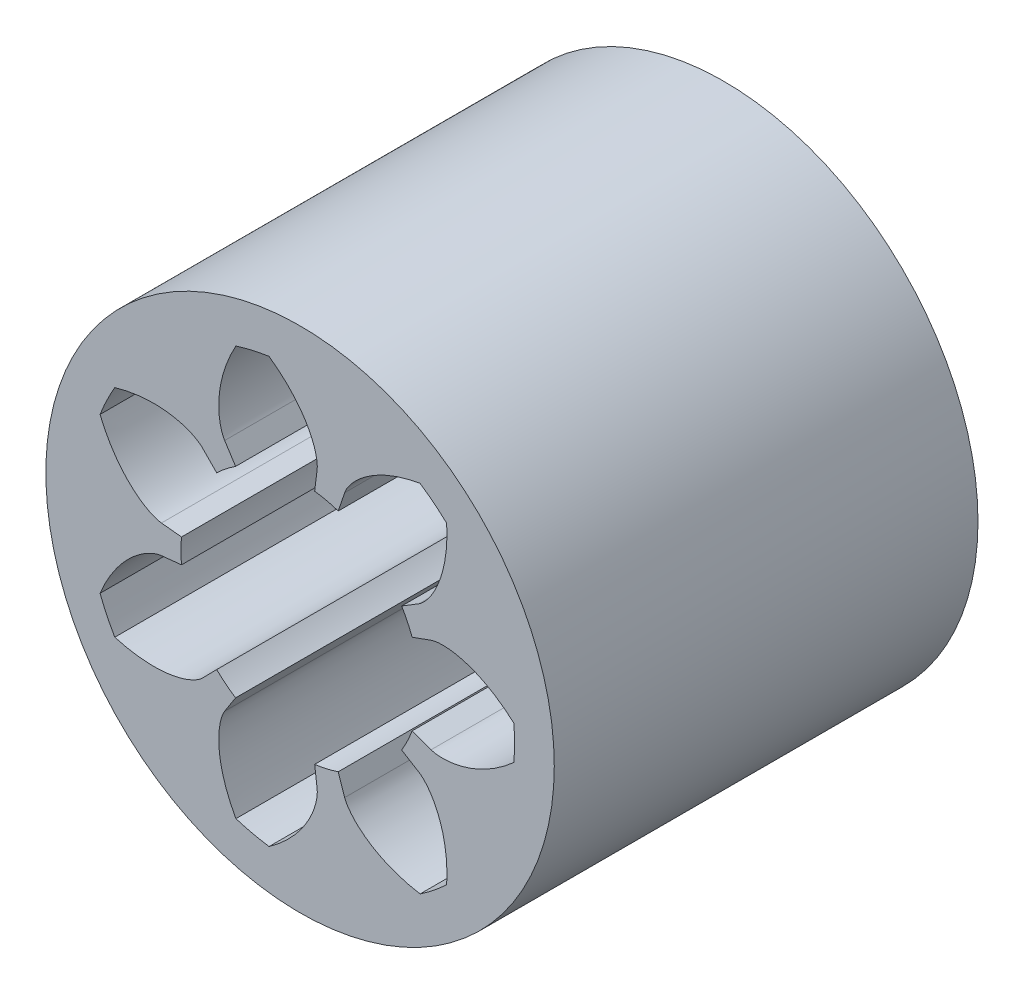
from build123d import *

# Parameters (mm, degrees)
SKETCH_1_R               = 3
SKETCH_1_R_2             = 1.40625
EXTRUDE_1_DEPTH          = 5
CUT_EXTRUDE_2_DEPTH      = 7.557438524
PATTERN_CIRCULAR_1_COUNT = 7


with BuildPart() as part:
    # 草图1 → 凸台-拉伸1 (new body)
    with BuildSketch(Plane.XY):
        Circle(SKETCH_1_R)
        Circle(SKETCH_1_R_2, mode=Mode.SUBTRACT)
    extrude(amount=EXTRUDE_1_DEPTH)

    # 草图1<3> → 切除-拉伸2 (cut, through all)
    with BuildSketch(Plane.XY):
        with BuildLine():
            Line((1.546319716, 0.559598866), (1.322324253, 0.478536971))
            ThreePointArc((1.322324253, 0.478536971), (1.385109661, 0.242920339), (1.40625, 0))
            ThreePointArc((1.40625, 0), (1.385109661, -0.242920339), (1.322324253, -0.478536971))
            Line((1.322324253, -0.478536971), (1.546319716, -0.559598866))
            add(Edge.make_bspline(
                [(1.546319716, -0.559598866), (1.558105463, -0.563864019), (1.591921474, -0.573215837), (1.658734166, -0.580959295), (1.767731952, -0.57845396), (1.907008009, -0.553308364), (2.079413065, -0.496026363), (2.261035814, -0.40341458), (2.393734523, -0.311147352), (2.48335867, -0.236539754), (2.523284743, -0.200650618)],
                knots=[0, 0, 0, 0, 0, 0.005604068, 0.015718248, 0.029959916, 0.048733667, 0.068727063, 0.096888892, 0.120945025, 0.120945025, 0.120945025, 0.120945025, 0.120945025], degree=4))
            ThreePointArc((2.523284743, -0.200650618), (2.529257902, -0.100404327), (2.53125, 0))
            ThreePointArc((2.53125, 0), (2.529257902, 0.100404327), (2.523284743, 0.200650618))
            add(Edge.make_bspline(
                [(1.546319716, 0.559598866), (1.558105463, 0.563864019), (1.591921474, 0.573215837), (1.658734166, 0.580959295), (1.767731952, 0.57845396), (1.907008009, 0.553308364), (2.079413065, 0.496026363), (2.261035814, 0.40341458), (2.393734523, 0.311147352), (2.48335867, 0.236539754), (2.523284743, 0.200650618)],
                knots=[0, 0, 0, 0, 0, 0.005604068, 0.015718248, 0.029959916, 0.048733667, 0.068727063, 0.096888892, 0.120945025, 0.120945025, 0.120945025, 0.120945025, 0.120945025], degree=4))
        make_face()
    cut_extrude_2 = extrude(amount=CUT_EXTRUDE_2_DEPTH, mode=Mode.SUBTRACT)

    # 阵列(圆周)1: 切除-拉伸2 ×7 about axis
    pattern_circular_1_axis = Axis((0, 0, 5), (0, 0, 1))
    for i in range(1, PATTERN_CIRCULAR_1_COUNT):
        add(cut_extrude_2.rotate(pattern_circular_1_axis, i * 360 / PATTERN_CIRCULAR_1_COUNT), mode=Mode.SUBTRACT)


solid = part.part
